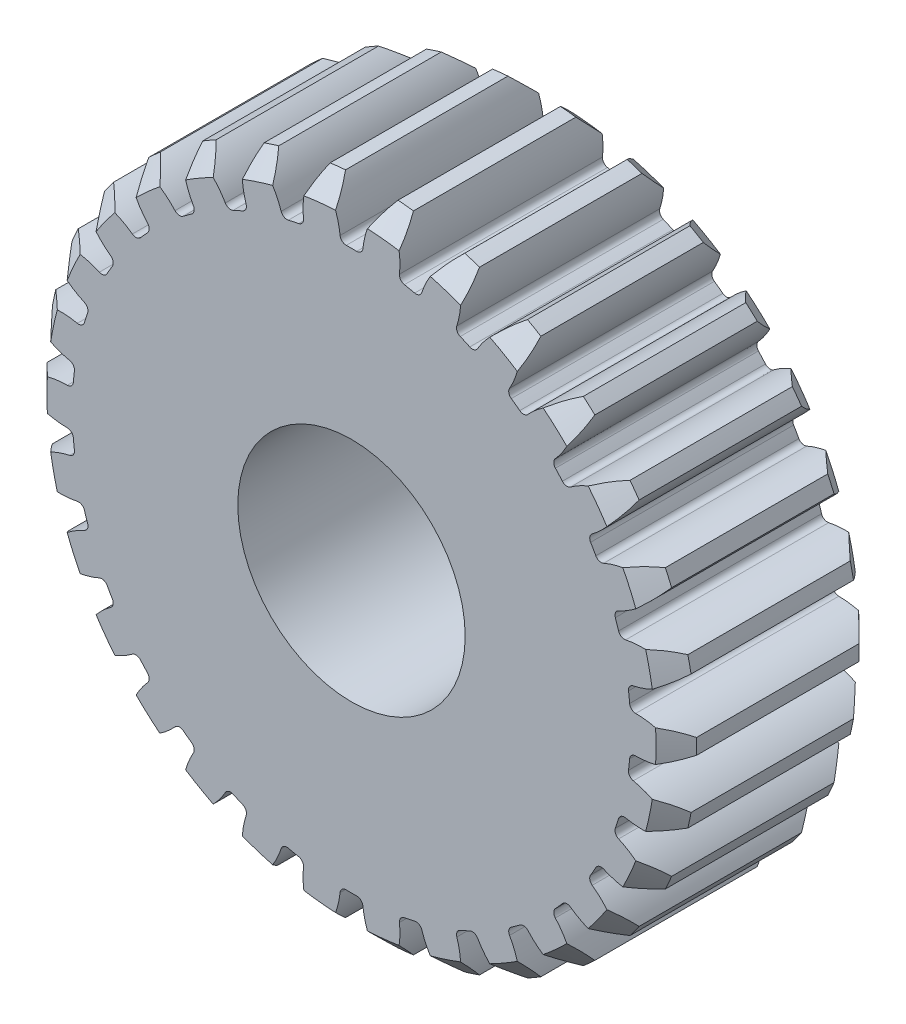
from build123d import *

# Parameters (mm, degrees)
SKETCH1_R                = 32
BOSS_EXTRUDE1_DEPTH      = 10
CUT_EXTRUDE1_DEPTH       = 50.477267507
CHAMFER1_SIZE            = 2
FILLET1_R                = 0.6
CIRPATTERN2_COUNT        = 30
FILLET1_OF_CIRPATTERN2_R = 0.6
CUT_EXTRUDE2_DEPTH       = 50.409675528
CUT_EXTRUDE2_DEPTH_BACK  = 50.409675528
SKETCH3_R                = 11.2


with BuildPart() as part:
    # Sketch1 → Boss-Extrude1 (new, symmetric)
    with BuildSketch(Plane.XY):
        Circle(SKETCH1_R)
    extrude(amount=BOSS_EXTRUDE1_DEPTH, both=True)

    # Sketch2 → Cut-Extrude1 (cut, symmetric)
    with BuildSketch(Plane.XY.offset(10)):
        with BuildLine():
            ThreePointArc((-2.585339624, 31.895391815), (-1.512823315, 29.796276093), (-1.082239285, 27.478696442))
            ThreePointArc((-1.082239285, 27.478696442), (0, 27.5), (1.082239285, 27.478696442))
            ThreePointArc((1.082239285, 27.478696442), (1.512823315, 29.796276093), (2.585339624, 31.895391815))
            ThreePointArc((2.585339624, 31.895391815), (0, 32), (-2.585339624, 31.895391815))
        make_face()
    cut_extrude1 = extrude(amount=CUT_EXTRUDE1_DEPTH, both=True, mode=Mode.SUBTRACT)

    # Chamfer1
    chamfer1_edges = [part.edges().sort_by_distance(p)[0] for p in [
        (0, -32, -10),
        (0, -32, 10),
    ]]
    chamfer(chamfer1_edges, length=CHAMFER1_SIZE)

    # Fillet1
    fillet1_edges = [part.edges().sort_by_distance(p)[0] for p in [
        (1.082239285, 27.478696442, 0),
        (-1.082239285, 27.478696442, 0),
    ]]
    fillet(fillet1_edges, radius=FILLET1_R)

    # CirPattern2: Cut-Extrude1 ×30 about axis
    cirpattern2_axis = Axis((0, 0, 0), (0, 0, 1))
    for i in range(1, CIRPATTERN2_COUNT):
        add(cut_extrude1.rotate(cirpattern2_axis, i * 360 / CIRPATTERN2_COUNT), mode=Mode.SUBTRACT)

    # Fillet1 of CirPattern2
    fillet1_of_cirpattern2_edges = [part.edges().sort_by_distance(p)[0] for p in [
        (-4.654552478, 27.103231195, 0),
        (-6.771731999, 26.653210796, 0),
        (-10.187917963, 25.54322469, 0),
        (-12.16526753, 24.662851942, 0),
        (-15.276022547, 22.866856696, 0),
        (-17.027122495, 21.594608113, 0),
        (-19.696491642, 19.191097337, 0),
        (-21.144810501, 17.582576287, 0),
        (-23.256129539, 14.676594935, 0),
        (-24.338368824, 12.802101507, 0),
        (-25.799362979, 9.520654908, 0),
        (-26.468223641, 7.462113459, 0),
        (-27.215040458, 3.948616577, 0),
        (-27.441290077, 1.795995246, 0),
        (-27.441290077, -1.795995246, 0),
        (-27.215040458, -3.948616577, 0),
        (-26.468223641, -7.462113459, 0),
        (-25.799362979, -9.520654908, 0),
        (-24.338368824, -12.802101507, 0),
        (-23.256129539, -14.676594935, 0),
        (-21.144810501, -17.582576287, 0),
        (-19.696491642, -19.191097337, 0),
        (-17.027122495, -21.594608113, 0),
        (-15.276022547, -22.866856696, 0),
        (-12.16526753, -24.662851942, 0),
        (-10.187917963, -25.54322469, 0),
        (-6.771731999, -26.653210796, 0),
        (-4.654552478, -27.103231195, 0),
        (-1.082239285, -27.478696442, 0),
        (1.082239285, -27.478696442, 0),
        (4.654552478, -27.103231195, 0),
        (6.771731999, -26.653210796, 0),
        (10.187917963, -25.54322469, 0),
        (12.16526753, -24.662851942, 0),
        (15.276022547, -22.866856696, 0),
        (17.027122495, -21.594608113, 0),
        (19.696491642, -19.191097337, 0),
        (21.144810501, -17.582576287, 0),
        (23.256129539, -14.676594935, 0),
        (24.338368824, -12.802101507, 0),
        (25.799362979, -9.520654908, 0),
        (26.468223641, -7.462113459, 0),
        (27.215040458, -3.948616577, 0),
        (27.441290077, -1.795995246, 0),
        (27.441290077, 1.795995246, 0),
        (27.215040458, 3.948616577, 0),
        (26.468223641, 7.462113459, 0),
        (25.799362979, 9.520654908, 0),
        (24.338368824, 12.802101507, 0),
        (23.256129539, 14.676594935, 0),
        (21.144810501, 17.582576287, 0),
        (19.696491642, 19.191097337, 0),
        (17.027122495, 21.594608113, 0),
        (15.276022547, 22.866856696, 0),
        (12.16526753, 24.662851942, 0),
        (10.187917963, 25.54322469, 0),
        (6.771731999, 26.653210796, 0),
        (4.654552478, 27.103231195, 0),
    ]]
    fillet(fillet1_of_cirpattern2_edges, radius=FILLET1_OF_CIRPATTERN2_R)

    # Sketch3 → Cut-Extrude2 (cut, two sides: drawn at the far end of the back side and taken through both)
    with BuildSketch(Plane(origin=(0, 0, -10), x_dir=(-1, 0, 0), z_dir=(0, 0, -1)).offset(-CUT_EXTRUDE2_DEPTH_BACK)):
        Circle(SKETCH3_R)
    extrude(amount=CUT_EXTRUDE2_DEPTH + CUT_EXTRUDE2_DEPTH_BACK, mode=Mode.SUBTRACT)


solid = part.part
